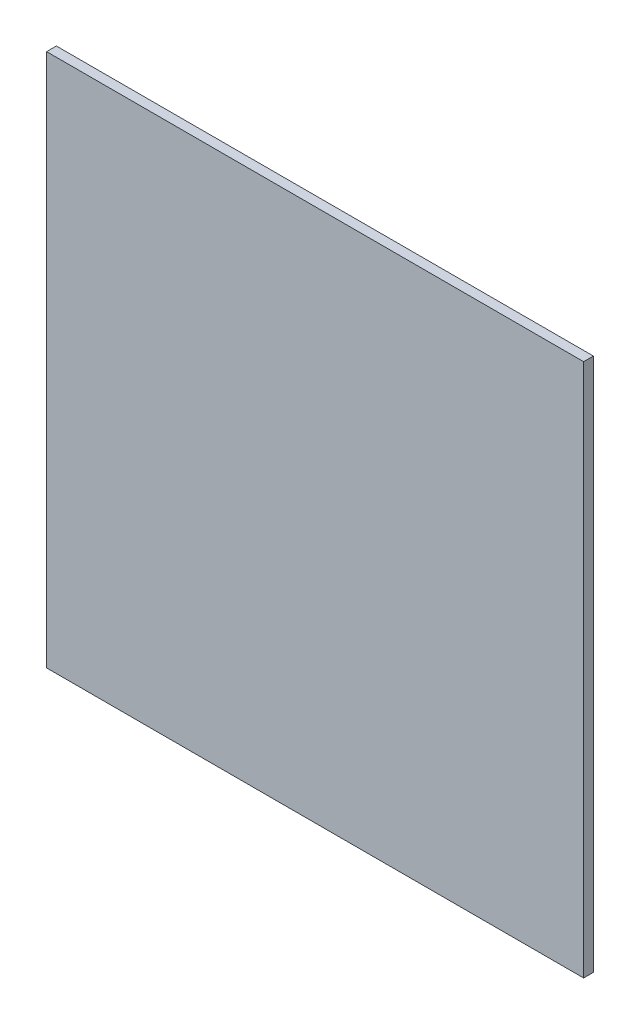
from build123d import *

# Parameters (mm, degrees)
ESQUISSE1_W        = 330
ESQUISSE1_H        = 328
BOSS_EXTRU_1_DEPTH = 6


with BuildPart() as part:
    # Esquisse1 → Boss.-Extru.1 (new body)
    with BuildSketch(Plane.XY):
        with Locations((-165, 164)):
            Rectangle(ESQUISSE1_W, ESQUISSE1_H)
    extrude(amount=BOSS_EXTRU_1_DEPTH)


solid = part.part
